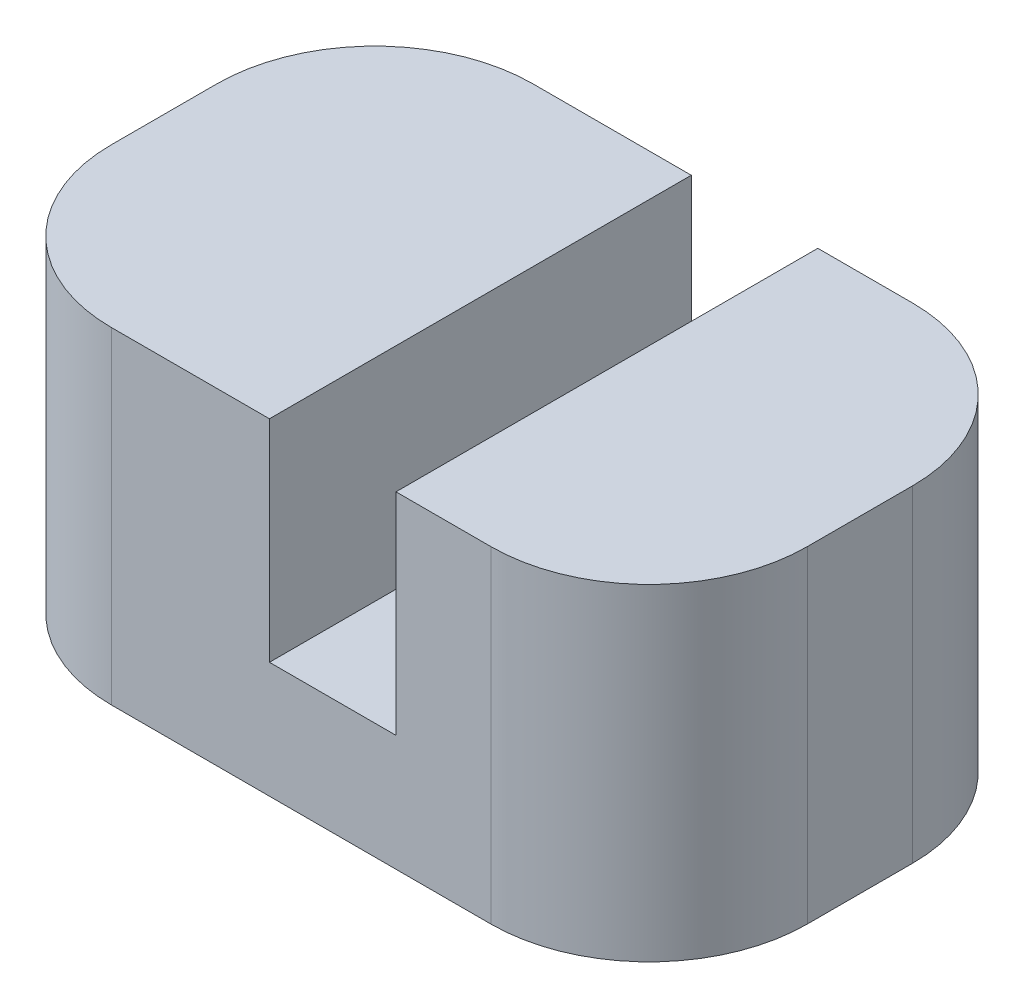
from build123d import *

# Parameters (mm, degrees)
CROQUIS1_W              = 33
CROQUIS1_H              = 20
SALIENTE_EXTRUIR1_DEPTH = 15.5
CROQUIS6_W              = 6
CROQUIS6_H              = 20
CORTAR_EXTRUIR2_DEPTH   = 10
REDONDEO1_R             = 7.5


with BuildPart() as part:
    # Croquis1 → Saliente-Extruir1 (new body)
    with BuildSketch(Plane(origin=(0, 0, 0), x_dir=(1, 0, 0), z_dir=(0, 1, 0))):
        with Locations((-1.5, 0)):
            Rectangle(CROQUIS1_W, CROQUIS1_H)
    extrude(amount=SALIENTE_EXTRUIR1_DEPTH)

    # Croquis6 → Cortar-Extruir2 (cut)
    with BuildSketch(Plane(origin=(0, 15.5, 0), x_dir=(1, 0, 0), z_dir=(0, 1, 0))):
        Rectangle(CROQUIS6_W, CROQUIS6_H)
    extrude(amount=-CORTAR_EXTRUIR2_DEPTH, mode=Mode.SUBTRACT)

    # Redondeo1
    redondeo1_edges = [part.edges().sort_by_distance(p)[0] for p in [
        (15, 7.75, 10),
        (-18, 7.75, 10),
        (-18, 7.75, -10),
        (15, 7.75, -10),
    ]]
    fillet(redondeo1_edges, radius=REDONDEO1_R)


solid = part.part
